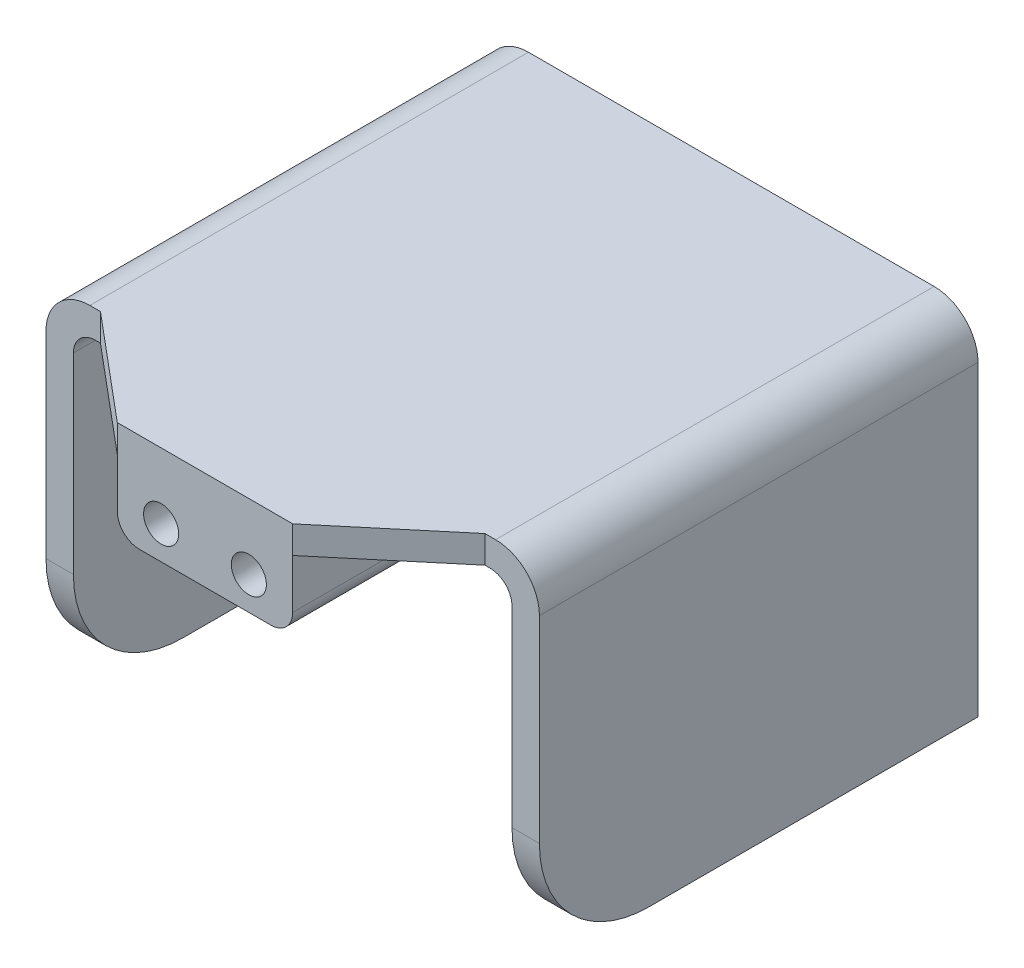
from build123d import *

# Parameters (mm, degrees)
SKETCH1_R           = 4
BOSS_EXTRUDE1_DEPTH = 120
CUT_EXTRUDE2_DEPTH  = 169.5
SKETCH4_R           = 5
BOSS_EXTRUDE3_DEPTH = 3.125
BOSS_EXTRUDE5_REACH = 156.803
SKETCH6_W           = 106.515256917
SKETCH6_H           = 6.25
FILLET1_R           = 25


with BuildPart() as part:
    # Sketch1 → Boss-Extrude1 (new body)
    with BuildSketch(Plane.XY):
        with BuildLine():
            Line((-45, 53.75), (-20, 53.75))
            Line((-20, 53.75), (-20, 42.5))
            ThreePointArc((-20, 42.5), (-18.535533906, 38.964466094), (-15, 37.5))
            Line((-15, 37.5), (15, 37.5))
            ThreePointArc((15, 37.5), (18.535533906, 38.964466094), (20, 42.5))
            Line((20, 42.5), (20, 53.75))
            Line((20, 53.75), (45, 53.75))
            ThreePointArc((45, 53.75), (48.535533906, 52.285533906), (50, 48.75))
            Line((50, 48.75), (50, -20))
            Line((50, -20), (56.25, -20))
            Line((56.25, -20), (56.25, 50))
            ThreePointArc((56.25, 50), (53.321067812, 57.071067812), (46.25, 60))
            Line((46.25, 60), (-46.25, 60))
            ThreePointArc((-46.25, 60), (-53.321067812, 57.071067812), (-56.25, 50))
            Line((-56.25, 50), (-56.25, -20))
            Line((-56.25, -20), (-50, -20))
            Line((-50, -20), (-50, 48.75))
            ThreePointArc((-50, 48.75), (-48.535533906, 52.285533906), (-45, 53.75))
        make_face()
        with Locations((-10, 45)):
            Circle(SKETCH1_R, mode=Mode.SUBTRACT)
        with Locations(Location((10, 45, 0), (0, 0, 180))):
            Circle(SKETCH1_R, mode=Mode.SUBTRACT)
    extrude(amount=BOSS_EXTRUDE1_DEPTH)

    # Sketch2 → Cut-Extrude2 (cut, symmetric)
    with BuildSketch(Plane(origin=(0, 0, 0), x_dir=(1, 0, 0), z_dir=(0, 1, 0))):
        Polygon((-20, -120), (-43.835071852, -100), (-56.25, -100), (-56.25, -170), (56.25, -170), (56.25, -100), (43.835071852, -100), (20, -120), align=None)
    extrude(amount=CUT_EXTRUDE2_DEPTH, both=True, mode=Mode.SUBTRACT)

    # Sketch4 → Boss-Extrude3 (add, symmetric)
    with BuildSketch(Plane(origin=(0, 0, 0), x_dir=(0, 0, -1), z_dir=(1, 0, 0))):
        with BuildLine():
            Line((0, 60), (0, -20))
            Line((0, -20), (28, 13.266499161))
            ThreePointArc((28, 13.266499161), (30.456578482, 20), (28, 26.733500839))
            Line((28, 26.733500839), (0, 60))
        make_face()
        with Locations((20, 20)):
            Circle(SKETCH4_R, mode=Mode.SUBTRACT)
    extrude(amount=BOSS_EXTRUDE3_DEPTH, both=True)

    # Boss-Extrude5: up to this face of the body (flat: up to its plane)
    boss_extrude5_end = Plane(part.part.faces().sort_by_distance((-32.103527113, 53.75, 54.932363347))[0])
    # Sketch6 → Boss-Extrude5 (add, up to the picked face)
    with BuildSketch(Plane.XZ.offset(20), mode=Mode.PRIVATE) as boss_extrude5_sk1:
        with Locations((-0.086289354, 3.125)):
            Rectangle(SKETCH6_W, SKETCH6_H)
    boss_extrude5_tool1 = split(extrude(boss_extrude5_sk1.sketch, amount=-BOSS_EXTRUDE5_REACH, mode=Mode.PRIVATE), bisect_by=boss_extrude5_end, keep=Keep.BOTH, mode=Mode.PRIVATE)
    add(boss_extrude5_tool1.solids().sort_by(Axis((-0.086289, -20, 3.125), (0, 1, 0)))[0])

    # Fillet1
    fillet1_edges = [part.edges().sort_by_distance(p)[0] for p in [
        (53.125, -20, 100),
        (-53.125, -20, 100),
    ]]
    fillet(fillet1_edges, radius=FILLET1_R)


solid = part.part
